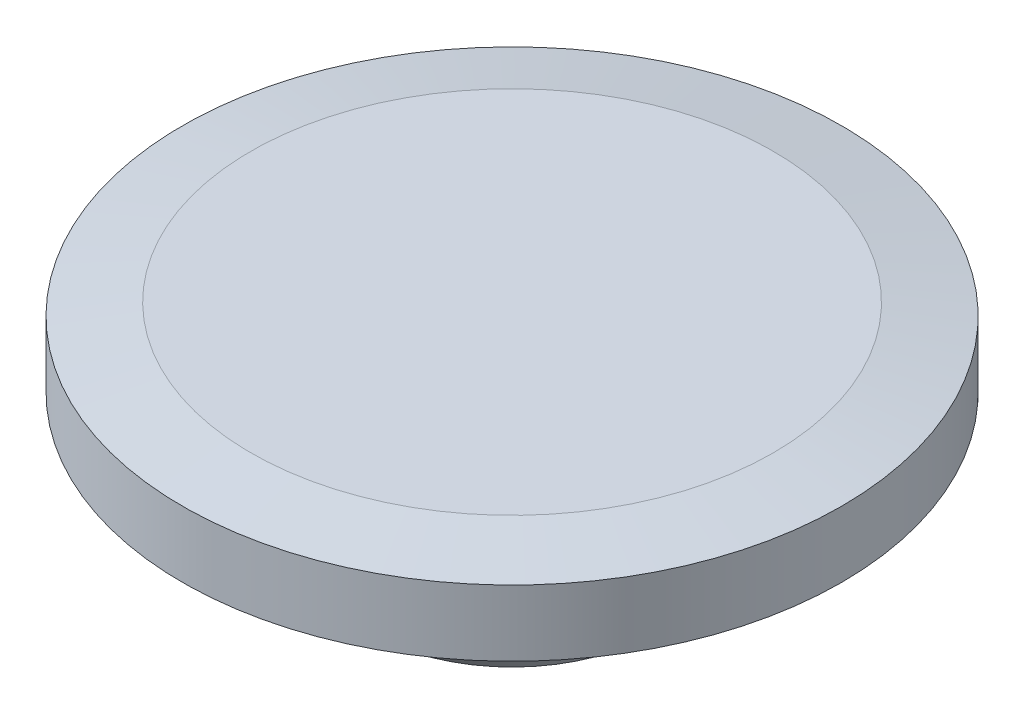
from build123d import *

# Parameters (mm, degrees)
CHAMFER2_SIZE           = 1
CHAMFER2_SIZE2          = 8.144346428
CUT_EXTRUDE1_DEPTH      = 28.792265111
CUT_EXTRUDE1_DEPTH_BACK = 5
CHAMFER1_SIZE           = 1
CHAMFER3_SIZE           = 0.5
CHAMFER3_SIZE2          = 0.288675135


with BuildPart() as part:
    # Sketch1 → Revolve1 (revolve)
    with BuildSketch(Plane.XY, mode=Mode.PRIVATE) as revolve1_sk:
        Polygon((-15.060768988, 5.5), (-19, 4.805407289), (-19, 0), (-10.35, 0), (-10.35, -0.35), (-8.6, -0.35), (-8.6, -6.85), (-5.6, -6.85), (-5.6, 3.4), (-3, 3.4), (-3, -1.6), (0, -1.6), (0, 5.5), align=None)
    revolve(revolve1_sk.sketch.rotate(Axis((0, -1.6, 0), (0, 1, 0)), 180), axis=Axis((0, -1.6, 0), (0, 1, 0)))

    # Chamfer2
    chamfer2_edges = [part.edges().sort_by_distance(p)[0] for p in [
        (-19, 0, 0),
    ]]
    chamfer2_side = [part.faces().sort_by_distance(p)[0] for p in [
        (-19, 2.402703645, 0),
    ]]
    chamfer(chamfer2_edges, length=CHAMFER2_SIZE, length2=CHAMFER2_SIZE2, reference=chamfer2_side[0])

    # Sketch2 → Cut-Extrude1 (cut, two sides: drawn at the far end of the back side and taken through both)
    with BuildSketch(Plane.XZ.offset(1.6).offset(-CUT_EXTRUDE1_DEPTH_BACK)):
        Polygon((-5.85, 1.85), (-6.6, 1.1), (-6.6, -1.1), (-5.85, -1.85), (-0.35, -1.85), (0.4, -1.1), (0.4, 1.1), (-0.35, 1.85), align=None)
    extrude(amount=CUT_EXTRUDE1_DEPTH + CUT_EXTRUDE1_DEPTH_BACK, mode=Mode.SUBTRACT)

    # Chamfer1
    chamfer1_edges = [part.edges().sort_by_distance(p)[0] for p in [
        (5.6, -6.85, 0),
    ]]
    chamfer(chamfer1_edges, length=CHAMFER1_SIZE)

    # Chamfer3
    chamfer3_edges = [part.edges().sort_by_distance(p)[0] for p in [
        (-8.6, -6.85, 0),
    ]]
    chamfer3_side = [part.faces().sort_by_distance(p)[0] for p in [
        (-8.6, -3.6, 0),
    ]]
    chamfer(chamfer3_edges, length=CHAMFER3_SIZE, length2=CHAMFER3_SIZE2, reference=chamfer3_side[0])


solid = part.part
